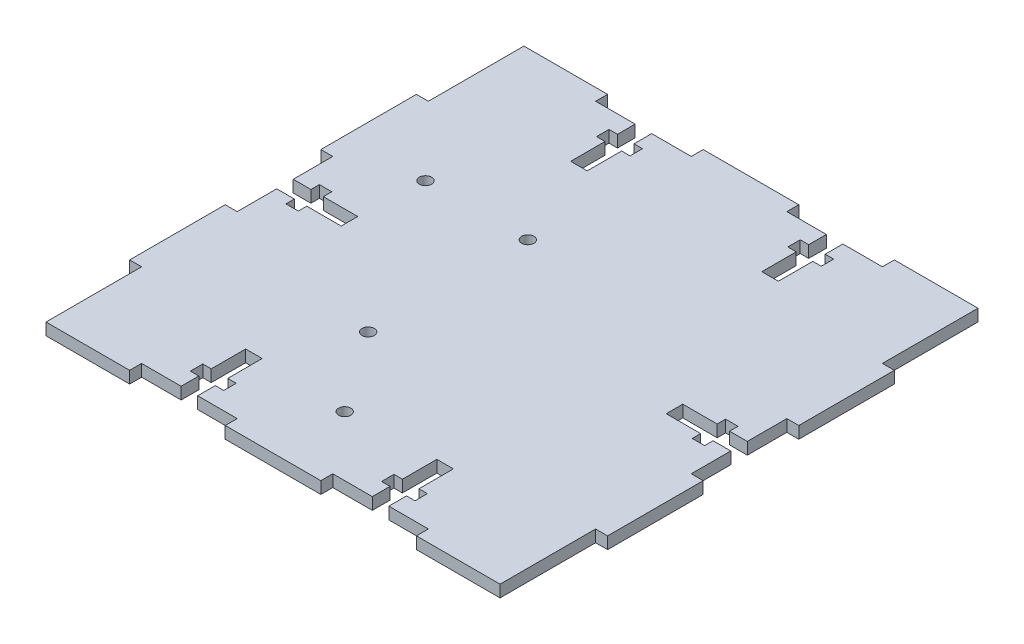
from build123d import *

# Parameters (mm, degrees)
SKETCH1_W                 = 127
SKETCH1_H                 = 127
BOSS_EXTRUDE1_DEPTH       = 3.175
SKETCH2_W                 = 3.175
SKETCH2_H                 = 25.4
CUT_EXTRUDE1_DEPTH        = 6.35
LPATTERN1_COUNT           = 3
LPATTERN1_PITCH           = 50.8
LPATTERN1_COUNT_DIR2      = 2
LPATTERN1_PITCH_DIR2      = 123.825
SKETCH3_W                 = 25.4
SKETCH3_H                 = 3.175
CUT_EXTRUDE2_DEPTH        = 6.35
LPATTERN2_COUNT           = 3
LPATTERN2_PITCH           = 50.8
LPATTERN2_COUNT_DIR2      = 2
LPATTERN2_PITCH_DIR2      = 123.825
SKETCH4_W                 = 17.145
SKETCH4_H                 = 4.3942
SKETCH4_W_2               = 3.302
SKETCH4_H_2               = 8.89
CUT_EXTRUDE3_DEPTH        = 8.89
SKETCH5_W                 = 4.3942
SKETCH5_H                 = 17.145
SKETCH5_W_2               = 8.89
SKETCH5_H_2               = 3.302
CUT_EXTRUDE4_DEPTH        = 30.48
LPATTERN3_COUNT           = 2
LPATTERN3_PITCH           = 50.8
MIRROR2_COPY_1_SKETCH_W   = 4.3942
MIRROR2_COPY_1_SKETCH_H   = 17.145
MIRROR2_COPY_1_SKETCH_W_2 = 8.89
MIRROR2_COPY_1_SKETCH_H_2 = 3.302
MIRROR2_COPY_1_DEPTH      = 30.48
F_4_CLEARANCE_HOLE3_D     = 3.2639
F_4_CLEARANCE_HOLE3_DEPTH = 10.16
F_4_CLEARANCE_HOLE3_TIP   = 0.980574487
F_4_CLEARANCE_HOLE4_D     = 3.2639
F_4_CLEARANCE_HOLE4_DEPTH = 10.16
F_4_CLEARANCE_HOLE4_TIP   = 0.980574487


with BuildPart() as part:
    # Sketch1 → Boss-Extrude1 (new body)
    with BuildSketch(Plane(origin=(0, 0, 0), x_dir=(1, 0, 0), z_dir=(0, 1, 0))):
        with Locations((63.5, 63.5)):
            Rectangle(SKETCH1_W, SKETCH1_H)
    extrude(amount=BOSS_EXTRUDE1_DEPTH)

    # Sketch2 → Cut-Extrude1 (cut)
    with BuildSketch(Plane(origin=(0, 3.175, 0), x_dir=(1, 0, 0), z_dir=(0, 1, 0))):
        with Locations((1.5875, 114.3)):
            Rectangle(SKETCH2_W, SKETCH2_H)
    cut_extrude1 = extrude(amount=-CUT_EXTRUDE1_DEPTH, mode=Mode.SUBTRACT)

    # LPattern1: Cut-Extrude1 3 × 2
    with Locations(*[(j * LPATTERN1_PITCH_DIR2, 0, i * LPATTERN1_PITCH) for i in range(LPATTERN1_COUNT) for j in range(LPATTERN1_COUNT_DIR2) if (i, j) != (0, 0)]):
        add(cut_extrude1, mode=Mode.SUBTRACT)

    # Sketch3 → Cut-Extrude2 (cut)
    with BuildSketch(Plane(origin=(0, 3.175, 0), x_dir=(1, 0, 0), z_dir=(0, 1, 0))):
        with Locations((38.1, 1.5875)):
            Rectangle(SKETCH3_W, SKETCH3_H)
    cut_extrude2 = extrude(amount=-CUT_EXTRUDE2_DEPTH, mode=Mode.SUBTRACT)

    # LPattern2: Cut-Extrude2 3 × 2
    with Locations(*[(i * LPATTERN2_PITCH, 0, -j * LPATTERN2_PITCH_DIR2) for i in range(LPATTERN2_COUNT) for j in range(LPATTERN2_COUNT_DIR2) if (i, j) != (0, 0)]):
        add(cut_extrude2, mode=Mode.SUBTRACT)

    # Sketch4 → Cut-Extrude3 (cut)
    with BuildSketch(Plane(origin=(0, 3.175, 0), x_dir=(1, 0, 0), z_dir=(0, 1, 0))):
        with Locations((115.2525, 63.5)):
            Rectangle(SKETCH4_W, SKETCH4_H)
        with Locations((117.475, 63.5)):
            Rectangle(SKETCH4_W_2, SKETCH4_H_2)
    cut_extrude3 = extrude(amount=-CUT_EXTRUDE3_DEPTH, mode=Mode.SUBTRACT)

    # Sketch5 → Cut-Extrude4 (cut)
    with BuildSketch(Plane(origin=(0, 3.175, 0), x_dir=(1, 0, 0), z_dir=(0, 1, 0))):
        with Locations((38.1, 11.7475)):
            Rectangle(SKETCH5_W, SKETCH5_H)
        with Locations((38.1, 9.525)):
            Rectangle(SKETCH5_W_2, SKETCH5_H_2)
    cut_extrude4 = extrude(amount=-CUT_EXTRUDE4_DEPTH, mode=Mode.SUBTRACT)

    # LPattern3: Cut-Extrude4 ×2
    with Locations(*[(i * LPATTERN3_PITCH, 0, 0) for i in range(1, LPATTERN3_COUNT)]):
        add(cut_extrude4, mode=Mode.SUBTRACT)

    # Mirror2: Cut-Extrude4 across plane
    add(cut_extrude4.mirror(Plane.XY.offset(-63.5)), mode=Mode.SUBTRACT)

    # Mirror2 copy 1 sketch → Mirror2 copy 1 (cut)
    with BuildSketch(Plane(origin=(50.8, 3.175, -127), x_dir=(1, 0, 0), z_dir=(0, 1, 0))):
        with Locations((38.1, -11.7475)):
            Rectangle(MIRROR2_COPY_1_SKETCH_W, MIRROR2_COPY_1_SKETCH_H)
        with Locations((38.1, -9.525)):
            Rectangle(MIRROR2_COPY_1_SKETCH_W_2, MIRROR2_COPY_1_SKETCH_H_2)
    extrude(amount=-MIRROR2_COPY_1_DEPTH, mode=Mode.SUBTRACT)

    # #4 Clearance Hole3
    with Locations(Plane(origin=(0, 3.175, 0), x_dir=(1, 0, 0), z_dir=(0, 1, 0))):
        with Locations((21.082, 82.931), (48.26, 82.931), (48.26, 40.513)):
            Hole(F_4_CLEARANCE_HOLE3_D / 2, depth=F_4_CLEARANCE_HOLE3_DEPTH)
            with Locations((0, 0, -(F_4_CLEARANCE_HOLE3_DEPTH + F_4_CLEARANCE_HOLE3_TIP / 2))):  # 118° drill point
                Cone(0, F_4_CLEARANCE_HOLE3_D / 2, F_4_CLEARANCE_HOLE3_TIP, mode=Mode.SUBTRACT)

    # #4 Clearance Hole4
    with Locations(Plane(origin=(0, 3.175, 0), x_dir=(1, 0, 0), z_dir=(0, 1, 0))):
        with Locations((63.5, 19.05)):
            Hole(F_4_CLEARANCE_HOLE4_D / 2, depth=F_4_CLEARANCE_HOLE4_DEPTH)
            with Locations((0, 0, -(F_4_CLEARANCE_HOLE4_DEPTH + F_4_CLEARANCE_HOLE4_TIP / 2))):  # 118° drill point
                Cone(0, F_4_CLEARANCE_HOLE4_D / 2, F_4_CLEARANCE_HOLE4_TIP, mode=Mode.SUBTRACT)

    # Mirror3: Cut-Extrude3 across plane
    add(cut_extrude3.mirror(Plane.ZY.offset(-63.5)), mode=Mode.SUBTRACT)


solid = part.part
